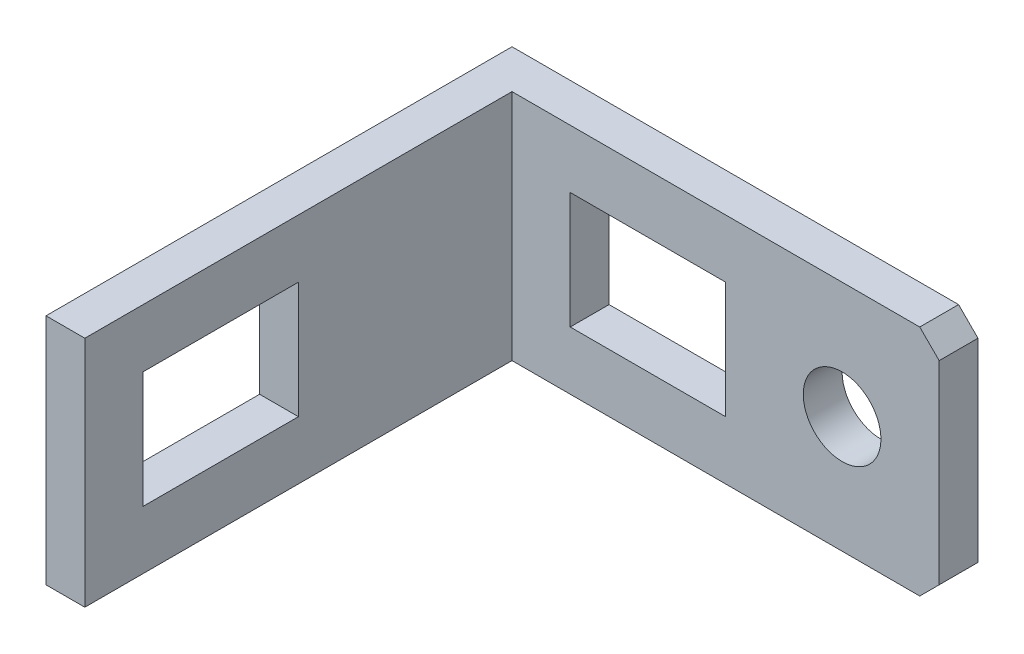
from build123d import *

# Parameters (mm, degrees)
SKETCH1_W           = 6.35
SKETCH1_H           = 69.85
SKETCH1_W_2         = 76.2
SKETCH1_H_2         = 6.35
BOSS_EXTRUDE1_DEPTH = 19.05
SKETCH2_R           = 6.35
CUT_EXTRUDE1_DEPTH  = 6.35
SKETCH3_W           = 25.4
SKETCH3_H           = 19.05
CUT_EXTRUDE2_DEPTH  = 6.35
CUT_EXTRUDE3_DEPTH  = 6.35
SKETCH5_W           = 25.4
SKETCH5_H           = 19.05
CUT_EXTRUDE4_DEPTH  = 6.35


with BuildPart() as part:
    # Sketch1 → Boss-Extrude1 (new, symmetric)
    with BuildSketch(Plane(origin=(0, 0, 0), x_dir=(1, 0, 0), z_dir=(0, 1, 0))):
        with Locations((-34.925, -38.1)):
            Rectangle(SKETCH1_W, SKETCH1_H)
        Rectangle(SKETCH1_W_2, SKETCH1_H_2)
    extrude(amount=BOSS_EXTRUDE1_DEPTH, both=True)

    # Sketch2 → Cut-Extrude1 (cut)
    with BuildSketch(Plane(origin=(0, 0, -3.175), x_dir=(-1, 0, 0), z_dir=(0, 0, -1))):
        with Locations((-22.225, 0)):
            Circle(SKETCH2_R)
    extrude(amount=-CUT_EXTRUDE1_DEPTH, mode=Mode.SUBTRACT)

    # Sketch3 → Cut-Extrude2 (cut)
    with BuildSketch(Plane(origin=(0, 0, -3.175), x_dir=(-1, 0, 0), z_dir=(0, 0, -1))):
        with Locations((9.525, 0)):
            Rectangle(SKETCH3_W, SKETCH3_H)
    extrude(amount=-CUT_EXTRUDE2_DEPTH, mode=Mode.SUBTRACT)

    # Sketch4 → Cut-Extrude3 (cut)
    with BuildSketch(Plane(origin=(0, 0, -3.175), x_dir=(-1, 0, 0), z_dir=(0, 0, -1))):
        Polygon((-34.925, 19.05), (-38.1, 15.875), (-38.1, 19.05), align=None)
        Polygon((-34.925, -19.05), (-38.1, -15.875), (-38.1, -19.05), align=None)
    extrude(amount=-CUT_EXTRUDE3_DEPTH, mode=Mode.SUBTRACT)

    # Sketch5 → Cut-Extrude4 (cut)
    with BuildSketch(Plane(origin=(-31.75, 0, 0), x_dir=(0, 0, -1), z_dir=(1, 0, 0))):
        with Locations((-50.8, 0)):
            Rectangle(SKETCH5_W, SKETCH5_H)
    extrude(amount=-CUT_EXTRUDE4_DEPTH, mode=Mode.SUBTRACT)


solid = part.part
